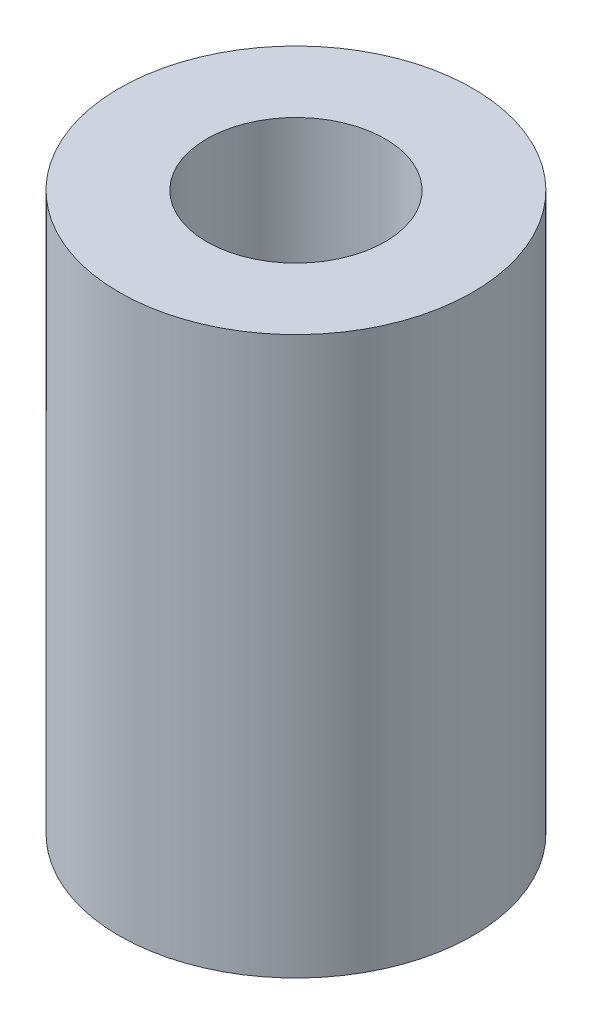
from build123d import *

# Parameters (mm, degrees)
SKETCH1_R           = 7.9756
SKETCH1_R_2         = 4.0259
BOSS_EXTRUDE1_DEPTH = 25.146


with BuildPart() as part:
    # Sketch1 → Boss-Extrude1 (new body)
    with BuildSketch(Plane(origin=(0, 0, 0), x_dir=(1, 0, 0), z_dir=(0, 1, 0))):
        with Locations(Location((0, 0, 0), (0, 0, 270))):
            Circle(SKETCH1_R)
        with Locations(Location((0, 0, 0), (0, 0, 270))):
            Circle(SKETCH1_R_2, mode=Mode.SUBTRACT)
    extrude(amount=BOSS_EXTRUDE1_DEPTH)


solid = part.part
